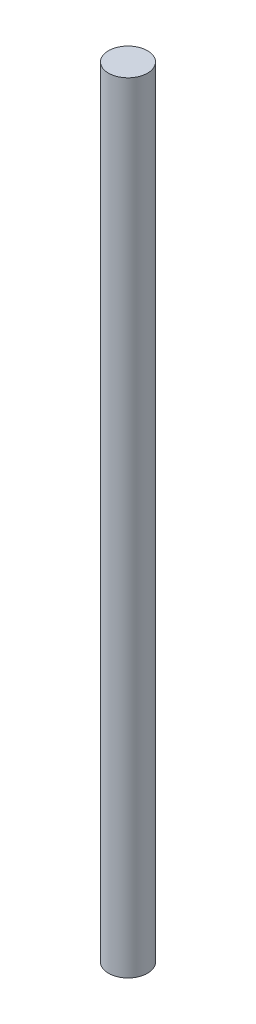
from build123d import *

# Parameters (mm, degrees)
SKETCH1_R           = 3
BOSS_EXTRUDE1_DEPTH = 120


with BuildPart() as part:
    # Sketch1 → Boss-Extrude1 (new body)
    with BuildSketch(Plane(origin=(0, 0, 0), x_dir=(1, 0, 0), z_dir=(0, 1, 0))):
        with Locations(Location((0, 0, 0), (0, 0, 270))):
            Circle(SKETCH1_R)
    extrude(amount=BOSS_EXTRUDE1_DEPTH)


solid = part.part
